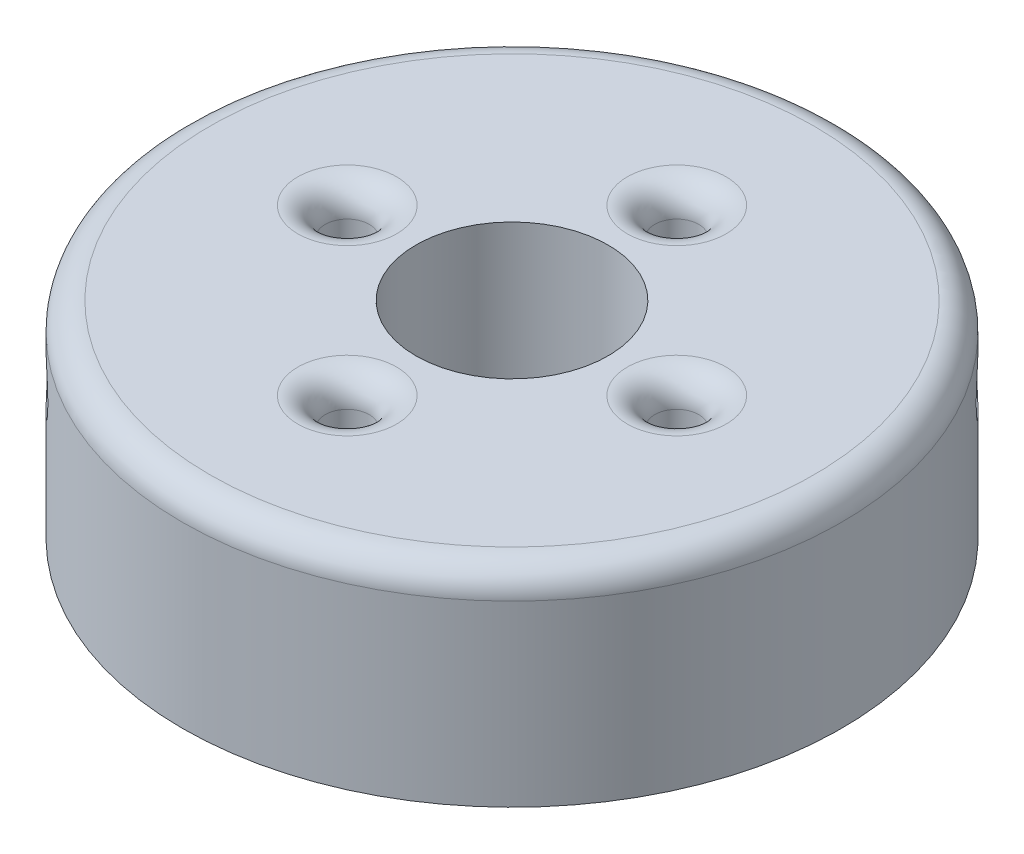
from build123d import *

# Parameters (mm, degrees)
SKETCH1_R           = 24
SKETCH1_R_2         = 7
SKETCH1_R_3         = 1.6
BOSS_EXTRUDE1_DEPTH = 15
BOSS_EXTRUDE2_START = -16
BOSS_EXTRUDE2_DEPTH = 16
CUT_EXTRUDE1_DEPTH  = 72
CUT_EXTRUDE2_START  = -72
CUT_EXTRUDE2_DEPTH  = 72
FILLET3_R           = 2


with BuildPart() as part:
    # Sketch1 → Boss-Extrude1 (new body)
    with BuildSketch(Plane(origin=(0, 0, 0), x_dir=(1, 0, 0), z_dir=(0, 1, 0))):
        with Locations(Location((0, 0, 0), (0, 0, 270))):
            Circle(SKETCH1_R)
        with Locations(Location((0, 0, 0), (0, 0, 270))):
            Circle(SKETCH1_R_2, mode=Mode.SUBTRACT)
        with Locations(Location((0, 12, 0), (0, 0, 270))):
            Circle(SKETCH1_R_3, mode=Mode.SUBTRACT)
        with Locations(Location((12, 0, 0), (0, 0, 270))):
            Circle(SKETCH1_R_3, mode=Mode.SUBTRACT)
        with Locations(Location((0, -12, 0), (0, 0, 270))):
            Circle(SKETCH1_R_3, mode=Mode.SUBTRACT)
        with Locations(Location((-12, 0, 0), (0, 0, 270))):
            Circle(SKETCH1_R_3, mode=Mode.SUBTRACT)
    extrude(amount=BOSS_EXTRUDE1_DEPTH)

    # Sketch3 → Boss-Extrude2 (add)
    with BuildSketch(Plane(origin=(0, 15, 0), x_dir=(1, 0, 0), z_dir=(0, 1, 0)).offset(BOSS_EXTRUDE2_START)):
        with BuildLine():
            Line((16.970562748, 16.970562748), (25.455844123, 8.485281374))
            Line((25.455844123, 8.485281374), (23.182219831, 6.211657082))
            ThreePointArc((23.182219831, 6.211657082), (20.784609691, 12), (16.970562748, 16.970562748))
        make_face()
    extrude(amount=BOSS_EXTRUDE2_DEPTH)

    # Sketch4 → Cut-Extrude1 (cut)
    with BuildSketch(Plane(origin=(16.970562748, 0, -16.970562748), x_dir=(-0.7071067811865489, 0, -0.7071067811865461), z_dir=(0.7071067811865461, 0, -0.7071067811865489))):
        with BuildLine():
            ThreePointArc((0, 12.1), (-2.1, 10), (0, 7.9))
            Line((0, 7.9), (0, 10))
            Line((0, 10), (0, 12.1))
        make_face()
        with BuildLine():
            Line((0, 10), (0, 7.9))
            ThreePointArc((0, 7.9), (1.48492424, 8.51507576), (2.1, 10))
            ThreePointArc((2.1, 10), (1.48492424, 11.48492424), (0, 12.1))
            Line((0, 12.1), (0, 10))
        make_face()
    extrude(amount=-CUT_EXTRUDE1_DEPTH, mode=Mode.SUBTRACT)

    # Sketch5 → Cut-Extrude2 (cut)
    with BuildSketch(Plane(origin=(0, 15, 0), x_dir=(1, 0, 0), z_dir=(0, 1, 0)).offset(CUT_EXTRUDE2_START)):
        with BuildLine():
            Line((23.182219831, 6.211657082), (25.455844123, 8.485281374))
            Line((25.455844123, 8.485281374), (16.970562748, 16.970562748))
            ThreePointArc((16.970562748, 16.970562748), (20.784609691, 12), (23.182219831, 6.211657082))
        make_face()
    extrude(amount=CUT_EXTRUDE2_DEPTH, mode=Mode.SUBTRACT)

    # Fillet3
    fillet3_edges = [part.edges().sort_by_distance(p)[0] for p in [
        (12, 15, -1.6),
        (0, 15, 10.4),
        (-12, 15, -1.6),
        (-20.784609691, 15, 12),
        (0, 15, -13.6),
    ]]
    fillet(fillet3_edges, radius=FILLET3_R)


solid = part.part
